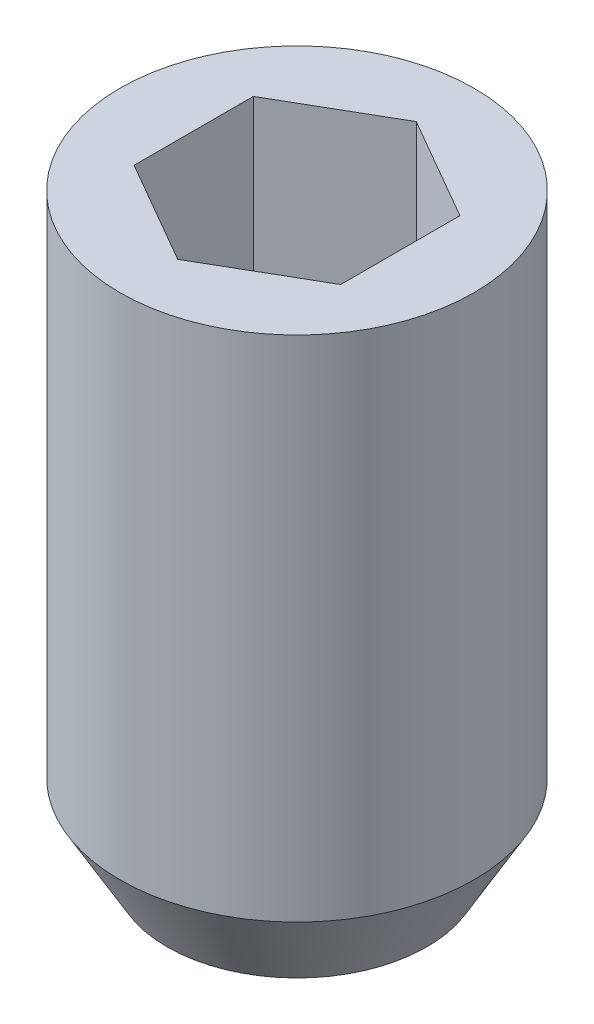
from build123d import *

# Parameters (mm, degrees)
SKETCH1_R           = 1.5
BOSS_EXTRUDE1_DEPTH = 5
CHAMFER1_SIZE       = 0.4
CHAMFER1_SIZE2      = 0.692820323
CUT_EXTRUDE1_DEPTH  = 3


with BuildPart() as part:
    # Sketch1 → Boss-Extrude1 (new body)
    with BuildSketch(Plane(origin=(0, 0, 0), x_dir=(1, 0, 0), z_dir=(0, 1, 0))):
        with Locations(Location((0, 0, 0), (0, 0, 270))):
            Circle(SKETCH1_R)
    extrude(amount=BOSS_EXTRUDE1_DEPTH)

    # Chamfer1
    chamfer1_edges = [part.edges().sort_by_distance(p)[0] for p in [
        (0, 0, -1.5),
    ]]
    chamfer1_side = [part.faces().sort_by_distance(p)[0] for p in [
        (0, 0, 0),
    ]]
    chamfer(chamfer1_edges, length=CHAMFER1_SIZE, length2=CHAMFER1_SIZE2, reference=chamfer1_side[0])

    # Sketch2 → Cut-Extrude1 (cut)
    with BuildSketch(Plane(origin=(0, 5, 0), x_dir=(1, 0, 0), z_dir=(0, 1, 0))):
        Polygon((0.875, -0.505181486), (0.875, 0.505181486), (0, 1.010362971), (-0.875, 0.505181486), (-0.875, -0.505181486), (0, -1.010362971), align=None)
    extrude(amount=-CUT_EXTRUDE1_DEPTH, mode=Mode.SUBTRACT)


solid = part.part
